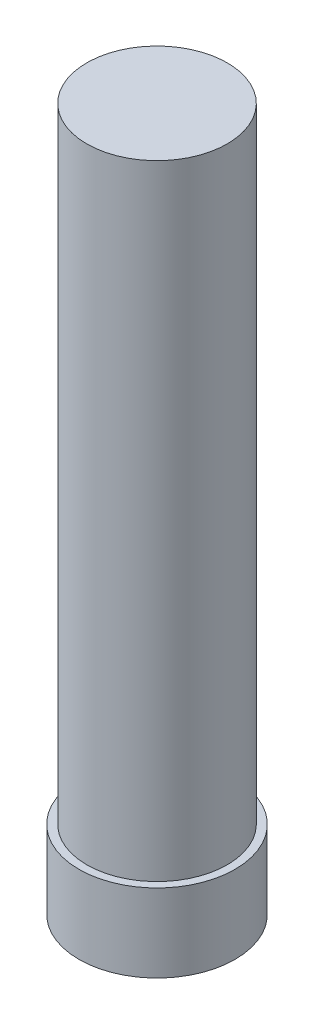
from build123d import *

# Parameters (mm, degrees)
SKETCH1_R           = 11.43
BOSS_EXTRUDE1_DEPTH = 101.6
SKETCH1_3_R         = 12.7
BOSS_EXTRUDE2_DEPTH = 12.7


with BuildPart() as part:
    # Sketch1 → Boss-Extrude1 (new body)
    with BuildSketch(Plane(origin=(0, 0, 0), x_dir=(1, 0, 0), z_dir=(0, 1, 0))):
        Circle(SKETCH1_R)
    extrude(amount=BOSS_EXTRUDE1_DEPTH)

    # Sketch1<3> → Boss-Extrude2 (add)
    with BuildSketch(Plane(origin=(0, 0, 0), x_dir=(1, 0, 0), z_dir=(0, 1, 0))):
        Circle(SKETCH1_3_R)
    extrude(amount=-BOSS_EXTRUDE2_DEPTH)


solid = part.part
